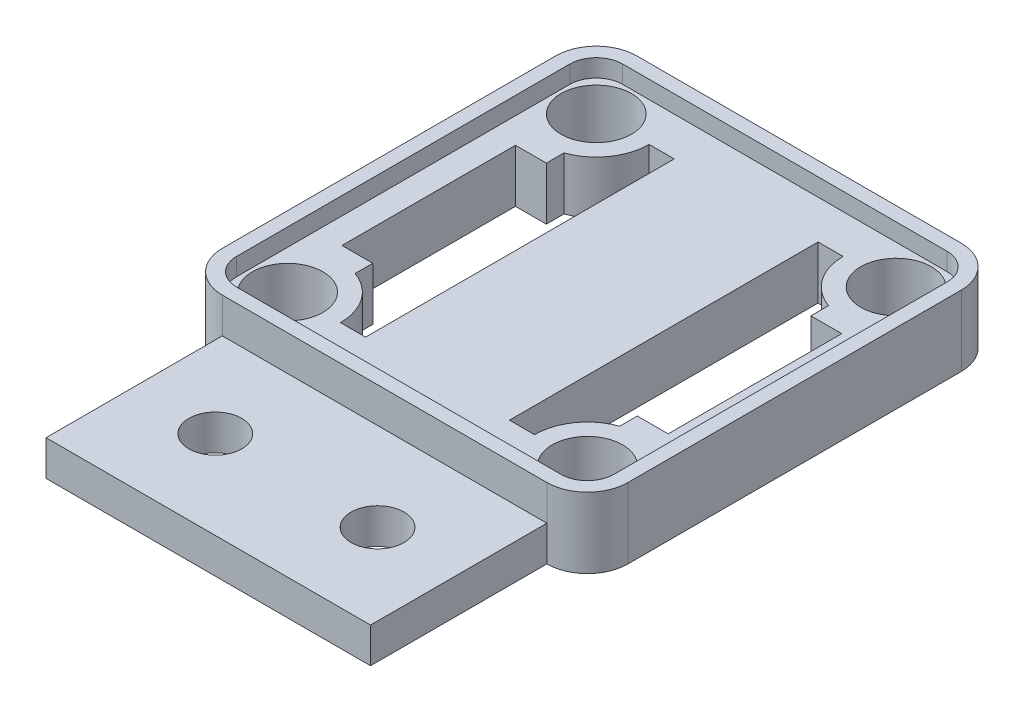
from build123d import *

# Parameters (mm, degrees)
BOSS_EXTRUDE1_DEPTH = 4
CUT_EXTRUDE2_DEPTH  = 1
SKETCH5_R           = 2
CUT_EXTRUDE3_DEPTH  = 22.132971525
CUT_EXTRUDE4_DEPTH  = 22.132971525
SKETCH7_W           = 18.4
SKETCH7_H           = 2
BOSS_EXTRUDE2_DEPTH = 10
SKETCH8_R           = 1.5
CUT_EXTRUDE5_DEPTH  = 25.154392176
CUT_EXTRUDE6_DEPTH  = 1
SKETCH11_W          = 1.421057218
SKETCH11_H          = 17.5
SKETCH11_W_2        = 1.75
SKETCH11_H_2        = 9.84
CUT_EXTRUDE7_DEPTH  = 25.257672217


with BuildPart() as part:
    # Sketch1 → Boss-Extrude1 (new body)
    with BuildSketch(Plane(origin=(0, 0, 0), x_dir=(1, 0, 0), z_dir=(0, 1, 0))):
        with BuildLine():
            Line((-12.649074074, 14.633101852), (5.750925926, 14.633101852))
            ThreePointArc((5.750925926, 14.633101852), (7.377271523, 13.959447449), (8.050925926, 12.333101852))
            Line((8.050925926, 12.333101852), (8.050925926, -6.566898148))
            ThreePointArc((8.050925926, -6.566898148), (7.377271523, -8.193243745), (5.750925926, -8.866898148))
            Line((5.750925926, -8.866898148), (-12.649074074, -8.866898148))
            ThreePointArc((-12.649074074, -8.866898148), (-14.275419671, -8.193243745), (-14.949074074, -6.566898148))
            Line((-14.949074074, -6.566898148), (-14.949074074, 12.333101852))
            ThreePointArc((-14.949074074, 12.333101852), (-14.275419671, 13.959447449), (-12.649074074, 14.633101852))
        make_face()
    extrude(amount=BOSS_EXTRUDE1_DEPTH)

    # Sketch2 → Cut-Extrude2 (cut)
    with BuildSketch(Plane(origin=(0, 4, 0), x_dir=(1, 0, 0), z_dir=(0, 1, 0))):
        with BuildLine():
            Line((5.750925926, 13.633101852), (-12.649074074, 13.633101852))
            ThreePointArc((-12.649074074, 13.633101852), (-13.56831289, 13.252340667), (-13.949074074, 12.333101852))
            Line((-13.949074074, 12.333101852), (-13.949074074, -6.566898148))
            ThreePointArc((-13.949074074, -6.566898148), (-13.56831289, -7.486136964), (-12.649074074, -7.866898148))
            Line((-12.649074074, -7.866898148), (5.750925926, -7.866898148))
            ThreePointArc((5.750925926, -7.866898148), (6.670164741, -7.486136964), (7.050925926, -6.566898148))
            Line((7.050925926, -6.566898148), (7.050925926, 12.333101852))
            ThreePointArc((7.050925926, 12.333101852), (6.670164741, 13.252340667), (5.750925926, 13.633101852))
        make_face()
    extrude(amount=-CUT_EXTRUDE2_DEPTH, mode=Mode.SUBTRACT)

    # Sketch5 → Cut-Extrude3 (cut, through all)
    with BuildSketch(Plane(origin=(0, 3, 0), x_dir=(1, 0, 0), z_dir=(0, 1, 0))):
        with Locations(Location((5.050925926, 11.633101852, 0), (0, 0, 270))):
            Circle(SKETCH5_R)
        with Locations(Location((5.050925926, -5.866898148, 0), (0, 0, 270))):
            Circle(SKETCH5_R)
        with Locations(Location((-11.949074074, -5.866898148, 0), (0, 0, 270))):
            Circle(SKETCH5_R)
        with Locations(Location((-11.949074074, 11.633101852, 0), (0, 0, 90))):
            Circle(SKETCH5_R)
    extrude(amount=-CUT_EXTRUDE3_DEPTH, mode=Mode.SUBTRACT)

    # Sketch6 → Cut-Extrude4 (cut, through all)
    with BuildSketch(Plane(origin=(0, 3, 0), x_dir=(1, 0, 0), z_dir=(0, 1, 0))):
        with BuildLine():
            Line((4.050925926, -3.038471023), (4.050925926, 8.804674727))
            ThreePointArc((4.050925926, 8.804674727), (2.601436183, 9.901051044), (2.050925926, 11.633101852))
            Line((2.050925926, 11.633101852), (2.050925926, -5.866898148))
            ThreePointArc((2.050925926, -5.866898148), (2.601436183, -4.134847341), (4.050925926, -3.038471023))
        make_face()
        with BuildLine():
            Line((-10.949074074, 8.804674727), (-10.949074074, -3.038471023))
            ThreePointArc((-10.949074074, -3.038471023), (-9.499584331, -4.134847341), (-8.949074074, -5.866898148))
            Line((-8.949074074, -5.866898148), (-8.949074074, 11.633101852))
            ThreePointArc((-8.949074074, 11.633101852), (-9.499584331, 9.901051044), (-10.949074074, 8.804674727))
        make_face()
    extrude(amount=-CUT_EXTRUDE4_DEPTH, mode=Mode.SUBTRACT)

    # Sketch7 → Boss-Extrude2 (add)
    with BuildSketch(Plane.XY.offset(8.866898148)):
        with Locations((-3.449074074, 1)):
            Rectangle(SKETCH7_W, SKETCH7_H)
    extrude(amount=BOSS_EXTRUDE2_DEPTH)

    # Sketch8 → Cut-Extrude5 (cut, through all)
    with BuildSketch(Plane(origin=(0, 2, 0), x_dir=(1, 0, 0), z_dir=(0, 1, 0))):
        with Locations(Location((1.150925926, -13.866898148, 0), (0, 0, 270))):
            Circle(SKETCH8_R)
        with Locations(Location((-8.049074074, -13.866898148, 0), (0, 0, 270))):
            Circle(SKETCH8_R)
    extrude(amount=-CUT_EXTRUDE5_DEPTH, mode=Mode.SUBTRACT)

    # Sketch9 → Cut-Extrude6 (cut)
    with BuildSketch(Plane(origin=(0, 4, 0), x_dir=(1, 0, 0), z_dir=(0, 1, 0))):
        with BuildLine():
            Line((5.750925926, 13.833101852), (-12.649074074, 13.833101852))
            ThreePointArc((-12.649074074, 13.833101852), (-13.709734246, 13.393762024), (-14.149074074, 12.333101852))
            Line((-14.149074074, 12.333101852), (-14.149074074, -6.566898148))
            ThreePointArc((-14.149074074, -6.566898148), (-13.709734246, -7.62755832), (-12.649074074, -8.066898148))
            Line((-12.649074074, -8.066898148), (5.750925926, -8.066898148))
            ThreePointArc((5.750925926, -8.066898148), (6.811586098, -7.62755832), (7.250925926, -6.566898148))
            Line((7.250925926, -6.566898148), (7.250925926, 12.333101852))
            ThreePointArc((7.250925926, 12.333101852), (6.811586098, 13.393762024), (5.750925926, 13.833101852))
        make_face()
    extrude(amount=-CUT_EXTRUDE6_DEPTH, mode=Mode.SUBTRACT)

    # Sketch11 → Cut-Extrude7 (cut, through all)
    with BuildSketch(Plane(origin=(0, 3, 0), x_dir=(1, 0, 0), z_dir=(0, 1, 0))):
        with Locations((-8.238545465, 2.883101852)):
            Rectangle(SKETCH11_W, SKETCH11_H)
        with Locations((1.340397317, 2.883101852)):
            Rectangle(SKETCH11_W, SKETCH11_H)
        with Locations((-11.824074074, 2.883101852)):
            Rectangle(SKETCH11_W_2, SKETCH11_H_2)
        with Locations((4.925925926, 2.883101852)):
            Rectangle(SKETCH11_W_2, SKETCH11_H_2)
    extrude(amount=-CUT_EXTRUDE7_DEPTH, mode=Mode.SUBTRACT)


solid = part.part
